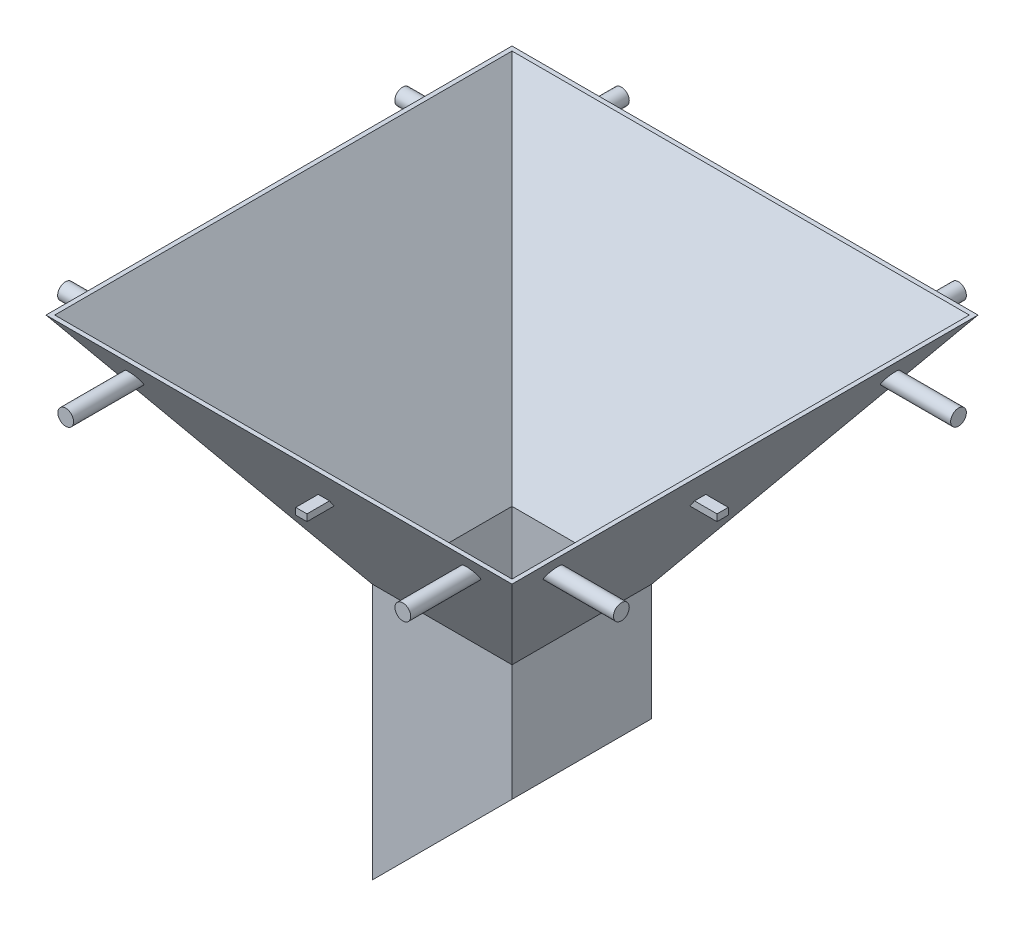
from build123d import *

# Parameters (mm, degrees)
CROQUIS4_W                          = 124.3
CROQUIS4_H                          = 124.3
SALIENTE_EXTRUIR1_DEPTH             = 103.7
SALIENTE_EXTRUIR2_DEPTH             = 124.3
VACIADO1_T                          = -3.175
SALIENTE_EXTRUIR3_REACH             = 732.428
CROQUIS6_R                          = 7
SALIENTE_EXTRUIR3_DIRECTION_2_DEPTH = 40
SALIENTE_EXTRUIR4_REACH             = 732.428
CROQUIS7_R                          = 7
SALIENTE_EXTRUIR4_DIRECTION_2_DEPTH = 40
SALIENTE_EXTRUIR5_REACH             = 755.858
CROQUIS8_R                          = 7
SALIENTE_EXTRUIR5_DIRECTION_2_DEPTH = 40
SALIENTE_EXTRUIR6_REACH             = 778.581
CROQUIS9_R                          = 7
SALIENTE_EXTRUIR6_DIRECTION_2_DEPTH = 40
CROQUIS10_W                         = 117.95
CROQUIS10_H                         = 117.95
CORTAR_EXTRUIR1_DEPTH               = 306
SALIENTE_EXTRUIR7_DEPTH             = 5
SALIENTE_EXTRUIR8_DEPTH             = 5


with BuildPart() as part:
    # Croquis2 → Recubrir1 section 0
    with BuildSketch(Plane(origin=(0, 0, 0), x_dir=(1, 0, 0), z_dir=(0, 1, 0))):
        with BuildLine():
            Line((0, 0), (414.7, 0))
            Line((414.7, 0), (414.7, 414.7))
            Line((414.7, 414.7), (0, 414.7))
            Line((0, 414.7), (0, 0))
        make_face()
    # Croquis3 → Recubrir1 section 1
    with BuildSketch(Plane(origin=(0, -207.4, 0), x_dir=(1, 0, 0), z_dir=(0, 1, 0))):
        with BuildLine():
            Line((145.2, 269.5), (269.5, 269.5))
            Line((269.5, 269.5), (269.5, 145.2))
            Line((269.5, 145.2), (145.2, 145.2))
            Line((145.2, 145.2), (145.2, 269.5))
        make_face()
    loft()

    # Croquis4 → Saliente-Extruir1 (add)
    with BuildSketch(Plane.XZ.offset(207.4)):
        with Locations((207.35, -207.35)):
            Rectangle(CROQUIS4_W, CROQUIS4_H)
    extrude(amount=SALIENTE_EXTRUIR1_DEPTH)

    # Croquis5 → Saliente-Extruir2 (add)
    with BuildSketch(Plane.XY.offset(-145.2)):
        Polygon((145.2, -311.1), (145.2, -435.4), (269.5, -311.1), align=None)
    extrude(amount=-SALIENTE_EXTRUIR2_DEPTH)

    # Vaciado1
    vaciado1_openings = [part.faces().sort_by_distance(p)[0] for p in [
        (207.35, 0, -207.35),
    ]]
    offset(amount=VACIADO1_T, openings=vaciado1_openings, kind=Kind.INTERSECTION)

    # Saliente-Extruir3: up to this plane
    saliente_extruir3_end = Plane(origin=(0, 0, 0), z_dir=(-0.819194806303917, -0.5735153610189425, 0))
    # Croquis6 → Saliente-Extruir3 (add, up to the surface)
    with BuildSketch(Plane(origin=(0, 0, 0), x_dir=(0, 0, -1), z_dir=(1, 0, 0)), mode=Mode.PRIVATE) as saliente_extruir3_sk1:
        with Locations((357.35, -30)):
            Circle(CROQUIS6_R)
    saliente_extruir3_tool1 = split(extrude(saliente_extruir3_sk1.sketch, amount=SALIENTE_EXTRUIR3_REACH, mode=Mode.PRIVATE), bisect_by=saliente_extruir3_end, keep=Keep.BOTH, mode=Mode.PRIVATE)
    add(saliente_extruir3_tool1.solids().sort_by_distance((0, -30, -357.35))[0])
    # Croquis6 → Saliente-Extruir3 (add, up to the surface)
    with BuildSketch(Plane(origin=(0, 0, 0), x_dir=(0, 0, -1), z_dir=(1, 0, 0)), mode=Mode.PRIVATE) as saliente_extruir3_sk2:
        with Locations(Location((57.35, -30, 0), (0, 0, 270))):
            Circle(CROQUIS6_R)
    saliente_extruir3_tool2 = split(extrude(saliente_extruir3_sk2.sketch, amount=SALIENTE_EXTRUIR3_REACH, mode=Mode.PRIVATE), bisect_by=saliente_extruir3_end, keep=Keep.BOTH, mode=Mode.PRIVATE)
    add(saliente_extruir3_tool2.solids().sort_by_distance((0, -30, -57.35))[0])

    # Croquis6 → Saliente-Extruir3 direction 2 (add)
    with BuildSketch(Plane(origin=(0, 0, 0), x_dir=(0, 0, -1), z_dir=(1, 0, 0))):
        with Locations((357.35, -30)):
            Circle(CROQUIS6_R)
        with Locations(Location((57.35, -30, 0), (0, 0, 270))):
            Circle(CROQUIS6_R)
    extrude(amount=-SALIENTE_EXTRUIR3_DIRECTION_2_DEPTH)

    # Saliente-Extruir4: up to this plane
    saliente_extruir4_end = Plane(origin=(0, 0, 0), z_dir=(0, -0.5735153610189427, 0.819194806303917))
    # Croquis7 → Saliente-Extruir4 (add, up to the surface)
    with BuildSketch(Plane.XY, mode=Mode.PRIVATE) as saliente_extruir4_sk1:
        with Locations((57.539107943, -30)):
            Circle(CROQUIS7_R)
    saliente_extruir4_tool1 = split(extrude(saliente_extruir4_sk1.sketch, amount=-SALIENTE_EXTRUIR4_REACH, mode=Mode.PRIVATE), bisect_by=saliente_extruir4_end, keep=Keep.BOTH, mode=Mode.PRIVATE)
    add(saliente_extruir4_tool1.solids().sort_by_distance((57.539108, -30, 0))[0])
    # Croquis7 → Saliente-Extruir4 (add, up to the surface)
    with BuildSketch(Plane.XY, mode=Mode.PRIVATE) as saliente_extruir4_sk2:
        with Locations(Location((357.539107943, -30, 0), (0, 0, 90))):
            Circle(CROQUIS7_R)
    saliente_extruir4_tool2 = split(extrude(saliente_extruir4_sk2.sketch, amount=-SALIENTE_EXTRUIR4_REACH, mode=Mode.PRIVATE), bisect_by=saliente_extruir4_end, keep=Keep.BOTH, mode=Mode.PRIVATE)
    add(saliente_extruir4_tool2.solids().sort_by_distance((357.539108, -30, 0))[0])

    # Croquis7 → Saliente-Extruir4 direction 2 (add)
    with BuildSketch(Plane.XY):
        with Locations((57.539107943, -30)):
            Circle(CROQUIS7_R)
        with Locations(Location((357.539107943, -30, 0), (0, 0, 90))):
            Circle(CROQUIS7_R)
    extrude(amount=SALIENTE_EXTRUIR4_DIRECTION_2_DEPTH)

    # Saliente-Extruir5: up to this plane
    saliente_extruir5_end = Plane(origin=(278.296930191, -194.834687868, 0), z_dir=(0.819194806303917, -0.5735153610189427, 0))
    # Croquis8 → Saliente-Extruir5 (add, up to the surface)
    with BuildSketch(Plane(origin=(414.7, 0, 0), x_dir=(0, 0, -1), z_dir=(1, 0, 0)), mode=Mode.PRIVATE) as saliente_extruir5_sk1:
        with Locations(Location((57.35, -30, 0), (0, 0, 270))):
            Circle(CROQUIS8_R)
    saliente_extruir5_tool1 = split(extrude(saliente_extruir5_sk1.sketch, amount=-SALIENTE_EXTRUIR5_REACH, mode=Mode.PRIVATE), bisect_by=saliente_extruir5_end, keep=Keep.BOTH, mode=Mode.PRIVATE)
    add(saliente_extruir5_tool1.solids().sort_by_distance((414.7, -30, -57.35))[0])
    # Croquis8 → Saliente-Extruir5 (add, up to the surface)
    with BuildSketch(Plane(origin=(414.7, 0, 0), x_dir=(0, 0, -1), z_dir=(1, 0, 0)), mode=Mode.PRIVATE) as saliente_extruir5_sk2:
        with Locations((357.35, -30)):
            Circle(CROQUIS8_R)
    saliente_extruir5_tool2 = split(extrude(saliente_extruir5_sk2.sketch, amount=-SALIENTE_EXTRUIR5_REACH, mode=Mode.PRIVATE), bisect_by=saliente_extruir5_end, keep=Keep.BOTH, mode=Mode.PRIVATE)
    add(saliente_extruir5_tool2.solids().sort_by_distance((414.7, -30, -357.35))[0])

    # Croquis8 → Saliente-Extruir5 direction 2 (add)
    with BuildSketch(Plane(origin=(414.7, 0, 0), x_dir=(0, 0, -1), z_dir=(1, 0, 0))):
        with Locations(Location((57.35, -30, 0), (0, 0, 270))):
            Circle(CROQUIS8_R)
        with Locations((357.35, -30)):
            Circle(CROQUIS8_R)
    extrude(amount=SALIENTE_EXTRUIR5_DIRECTION_2_DEPTH)

    # Saliente-Extruir6: up to this plane
    saliente_extruir6_end = Plane(origin=(0, -194.834687868, -278.296930191), z_dir=(0, -0.573515361018943, -0.8191948063039168))
    # Croquis9 → Saliente-Extruir6 (add, up to the surface)
    with BuildSketch(Plane(origin=(0, 0, -414.7), x_dir=(-1, 0, 0), z_dir=(0, 0, -1)), mode=Mode.PRIVATE) as saliente_extruir6_sk1:
        with Locations((-357.35, -30)):
            Circle(CROQUIS9_R)
    saliente_extruir6_tool1 = split(extrude(saliente_extruir6_sk1.sketch, amount=-SALIENTE_EXTRUIR6_REACH, mode=Mode.PRIVATE), bisect_by=saliente_extruir6_end, keep=Keep.BOTH, mode=Mode.PRIVATE)
    add(saliente_extruir6_tool1.solids().sort_by_distance((357.35, -30, -414.7))[0])
    # Croquis9 → Saliente-Extruir6 (add, up to the surface)
    with BuildSketch(Plane(origin=(0, 0, -414.7), x_dir=(-1, 0, 0), z_dir=(0, 0, -1)), mode=Mode.PRIVATE) as saliente_extruir6_sk2:
        with Locations(Location((-57.35, -30, 0), (0, 0, 90))):
            Circle(CROQUIS9_R)
    saliente_extruir6_tool2 = split(extrude(saliente_extruir6_sk2.sketch, amount=-SALIENTE_EXTRUIR6_REACH, mode=Mode.PRIVATE), bisect_by=saliente_extruir6_end, keep=Keep.BOTH, mode=Mode.PRIVATE)
    add(saliente_extruir6_tool2.solids().sort_by_distance((57.35, -30, -414.7))[0])

    # Croquis9 → Saliente-Extruir6 direction 2 (add)
    with BuildSketch(Plane(origin=(0, 0, -414.7), x_dir=(-1, 0, 0), z_dir=(0, 0, -1))):
        with Locations((-357.35, -30)):
            Circle(CROQUIS9_R)
        with Locations(Location((-57.35, -30, 0), (0, 0, 90))):
            Circle(CROQUIS9_R)
    extrude(amount=SALIENTE_EXTRUIR6_DIRECTION_2_DEPTH)

    # Croquis10 → Cortar-Extruir1 (cut)
    with BuildSketch(Plane(origin=(0, -207.4, 0), x_dir=(1, 0, 0), z_dir=(0, 1, 0))):
        with Locations((207.35, 207.35)):
            Rectangle(CROQUIS10_W, CROQUIS10_H)
    extrude(amount=-CORTAR_EXTRUIR1_DEPTH, mode=Mode.SUBTRACT)

    # Croquis13 → Saliente-Extruir7 (add, symmetric)
    with BuildSketch(Plane.ZY.offset(-207.35)):
        Polygon((-39.905496625, -57), (-19.905496625, -57), (-19.905496625, -63), (-44.106075217, -63), align=None)
        Polygon((-370.593924783, -63), (-374.794503375, -57), (-394.794503375, -57), (-394.794503375, -63), align=None)
    extrude(amount=SALIENTE_EXTRUIR7_DEPTH, both=True)

    # Croquis14 → Saliente-Extruir8 (add, symmetric)
    with BuildSketch(Plane.XY.offset(-207.35)):
        Polygon((39.905496625, -57), (19.905496625, -57), (19.905496625, -63), (44.106075217, -63), align=None)
        Polygon((370.593924783, -63), (374.794503375, -57), (394.794503375, -57), (394.794503375, -63), align=None)
    extrude(amount=SALIENTE_EXTRUIR8_DEPTH, both=True)


solid = part.part
